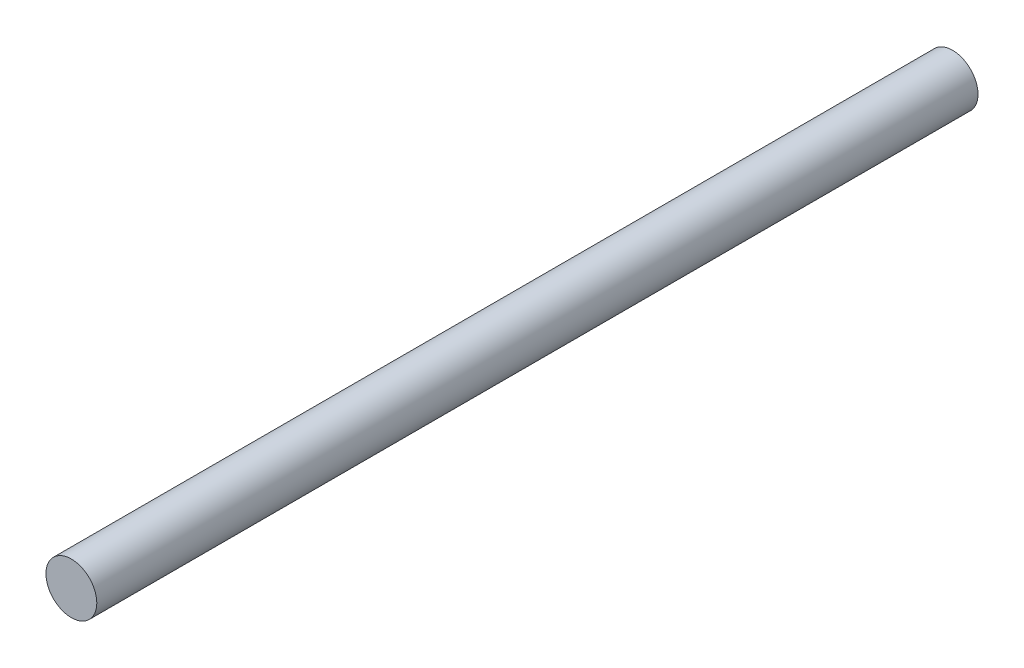
from build123d import *

# Parameters (mm, degrees)
SKETCH1_R           = 2.38125
BOSS_EXTRUDE1_DEPTH = 82.55


with BuildPart() as part:
    # Sketch1 → Boss-Extrude1 (new body)
    with BuildSketch(Plane.XY):
        Circle(SKETCH1_R)
    extrude(amount=BOSS_EXTRUDE1_DEPTH)


solid = part.part
